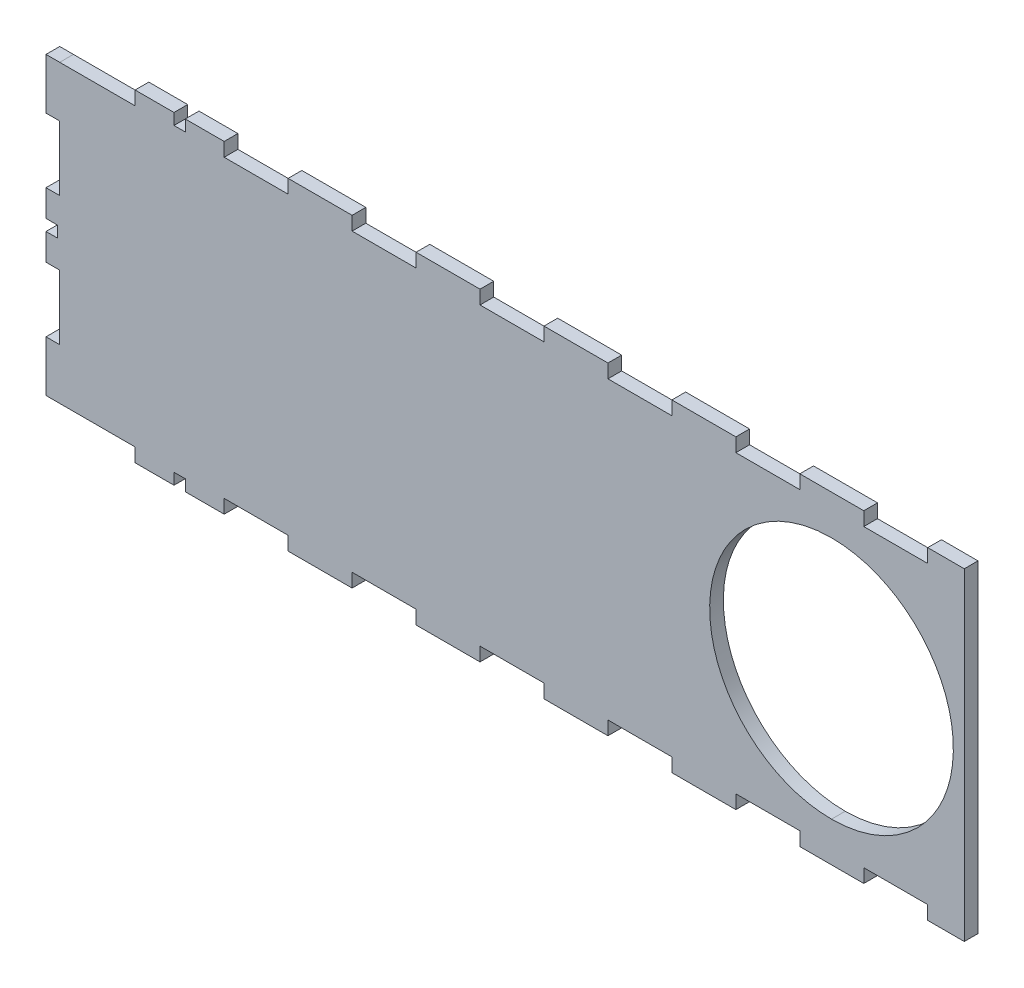
from build123d import *

# Parameters (mm, degrees)
BOSS_EXTRUDE1_DEPTH = 4.5


with BuildPart() as part:
    # Model → Boss-Extrude1 (new body)
    with BuildSketch(Plane.XY):
        Polygon((760.050761477, -1228.002546082), (747.275655091, -1228.002546082), (747.275655091, -1232.502544136), (722.525753986, -1232.502544136), (718.025755932, -1232.502508859), (718.025755932, -1249.202620799), (722.525753986, -1249.202620799), (722.525753986, -1270.402342738), (718.025755932, -1270.402342738), (718.025755932, -1279.15257218), (721.725795097, -1279.15257218), (721.725795097, -1282.852258568), (718.025755932, -1282.852258568), (718.025755932, -1291.602452733), (722.525753986, -1291.602452733), (722.525753986, -1312.80252745), (718.025755932, -1312.80252745), (718.025755932, -1329.502286612), (747.275655091, -1329.502286612), (747.275655091, -1334.002249389), (760.050761477, -1334.002249389), (760.050761477, -1330.302245501), (763.750800642, -1330.302245501), (763.750800642, -1334.002249389), (776.52555425, -1334.002249389), (776.52555425, -1329.502286612), (797.525462856, -1329.502286612), (797.525462856, -1334.002249389), (818.525759518, -1334.002249389), (818.525759518, -1329.502286612), (839.525668123, -1329.502286612), (839.525668123, -1334.002249389), (860.525612007, -1334.002249389), (860.525612007, -1329.502286612), (881.525520613, -1329.502286612), (881.525520613, -1334.002249389), (902.525429219, -1334.002249389), (902.525429219, -1329.502286612), (923.525514214, -1329.502286612), (923.525514214, -1334.002249389), (944.525422819, -1334.002249389), (944.525422819, -1329.502286612), (965.525401981, -1329.502286612), (965.525401981, -1334.002249389), (986.525310587, -1334.002249389), (986.525310587, -1329.502286612), (1007.525607248, -1329.502286612), (1007.52557197, -1334.002249389), (1019.525696134, -1334.002249389), (1019.525696134, -1228.010060249), (1007.525430859, -1227.995031915), (1007.525430859, -1232.510058303), (986.525486976, -1232.510058303), (986.525486976, -1228.010060249), (965.52557837, -1228.010060249), (965.52557837, -1232.502544136), (944.525634486, -1232.502544136), (944.525634486, -1228.002546082), (923.52572588, -1228.002546082), (923.52572588, -1232.502544136), (902.525781997, -1232.502544136), (902.525781997, -1228.002546082), (881.525873391, -1228.002546082), (881.525873391, -1232.502544136), (860.525612007, -1232.502544136), (860.525612007, -1228.002546082), (839.525668123, -1228.002546082), (839.525668123, -1232.502544136), (818.525759518, -1232.502544136), (818.525759518, -1228.002546082), (797.525462856, -1228.002546082), (797.525462856, -1232.502544136), (776.52555425, -1232.502544136), (776.52555425, -1228.002546082), (763.750800642, -1228.002546082), (763.750800642, -1231.70254997), (760.050761477, -1231.70254997), align=None)
        with BuildLine():
            add(Edge.make_bspline(
                [(975.928536423, -1321.002388281), (953.837062817, -1321.002388281), (935.928404766, -1303.093765508), (935.928404766, -1281.002433013), (935.928404766, -1258.911100519), (953.837062817, -1241.002442468), (975.928536423, -1241.002442468)],
                knots=[2, 2, 2, 2, 3, 3, 3, 4, 4, 4, 4], degree=3))
            add(Edge.make_bspline(
                [(975.928536423, -1241.002442468), (998.020045306, -1241.002442468), (1015.928703357, -1258.911100519), (1015.928703357, -1281.002433013), (1015.928703357, -1303.093765508), (998.020045306, -1321.002388281), (975.928536423, -1321.002388281)],
                knots=[0, 0, 0, 0, 1, 1, 1, 2, 2, 2, 2], degree=3))
        make_face(mode=Mode.SUBTRACT)
    extrude(amount=BOSS_EXTRUDE1_DEPTH)


solid = part.part
